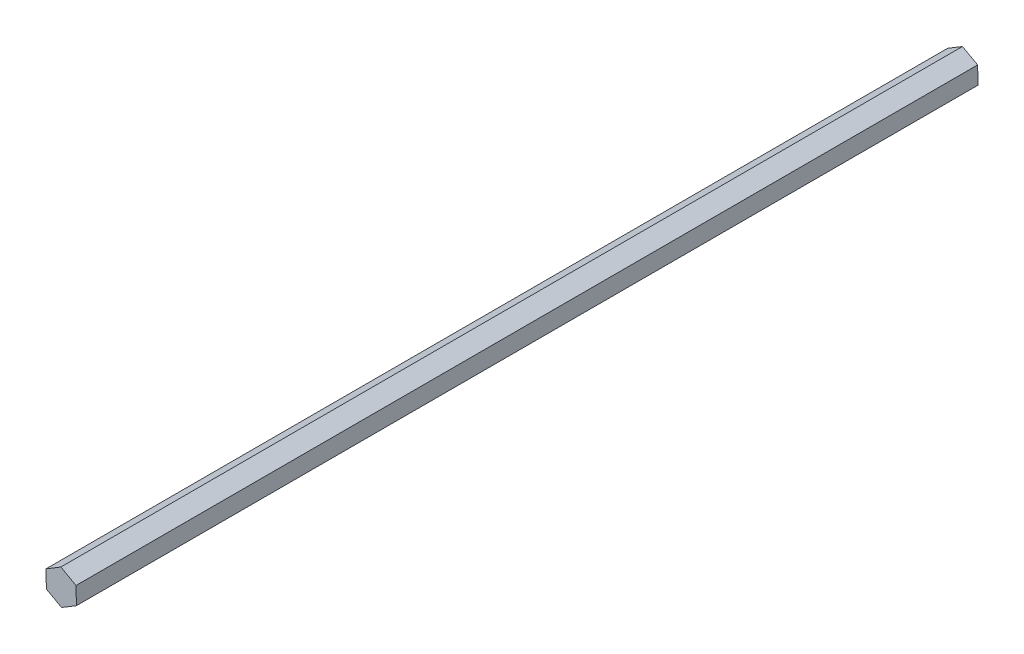
from build123d import *

# Parameters (mm, degrees)
BOSS_EXTRUDE1_DEPTH = 381


with BuildPart() as part:
    # Sketch1 → Boss-Extrude1 (new body)
    with BuildSketch(Plane.XY):
        Polygon((-0.152459547, 7.330763222), (-6.424856953, 3.53334777), (-6.272397406, -3.797415452), (0.152459547, -7.330763222), (6.424856953, -3.53334777), (6.272397406, 3.797415452), align=None)
    extrude(amount=BOSS_EXTRUDE1_DEPTH)


solid = part.part
